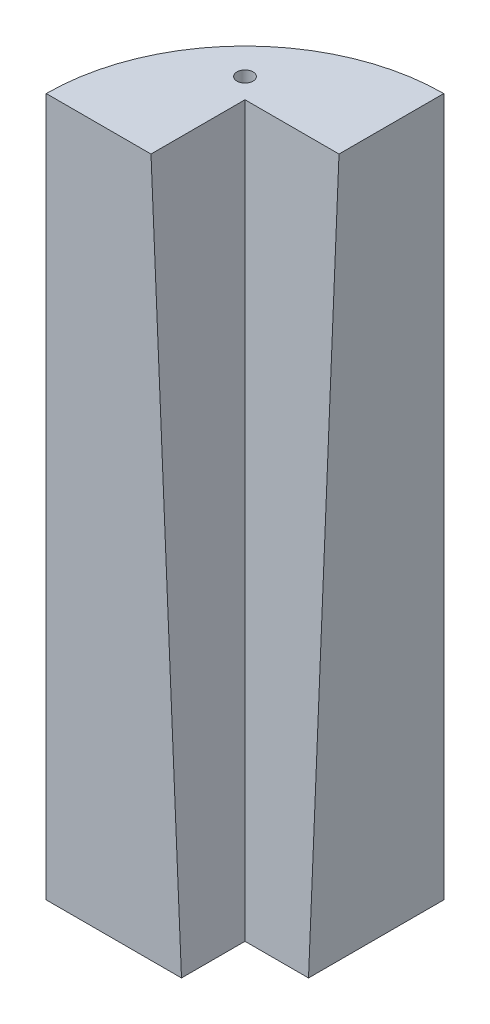
from build123d import *

# Parameters (mm, degrees)
SKETCH1_R           = 46.99
BOSS_EXTRUDE1_DEPTH = 330.2
SKETCH2_W           = 44.45
SKETCH2_H           = 44.45
CUT_EXTRUDE1_DEPTH  = 330.2
CUT_EXTRUDE1_DRAFT  = -2.5
CUT_EXTRUDE2_START  = -330.2
SKETCH3_R           = 1.905
CUT_EXTRUDE2_DEPTH  = 330.2
CUT_EXTRUDE3_DEPTH  = 165.1


with BuildPart() as part:
    # Sketch1 → Boss-Extrude1 (new body)
    with BuildSketch(Plane(origin=(0, 0, 0), x_dir=(1, 0, 0), z_dir=(0, 1, 0))):
        with Locations(Location((0, 0, 0), (0, 0, 270))):
            Circle(SKETCH1_R)
    extrude(amount=BOSS_EXTRUDE1_DEPTH)


with BuildPart() as cut_extrude1_tool:
    # Sketch2 → Cut-Extrude1 (with draft: the straight prism first)
    with BuildSketch(Plane(origin=(0, 330.2, 0), x_dir=(1, 0, 0), z_dir=(0, 1, 0))):
        Rectangle(SKETCH2_W, SKETCH2_H)
    extrude(amount=-CUT_EXTRUDE1_DEPTH)
    # Cut-Extrude1: the draft: its side faces are tilted about the plane it starts from
    cut_extrude1_sides = [cut_extrude1_tool.faces().sort_by_distance(p)[0] for p in [
        (-22.225, 165.1, 0),
        (0, 165.1, 22.225),
        (22.225, 165.1, 0),
        (0, 165.1, -22.225),
    ]]
    draft(cut_extrude1_sides, Plane(origin=(0, 330.2, 0), x_dir=(1, 0, 0), z_dir=(0, 1, 0)), CUT_EXTRUDE1_DRAFT)


with BuildPart() as part_1:
    add(part.part)

    # Cut-Extrude1: cut by cut_extrude1_tool
    add(cut_extrude1_tool.part, mode=Mode.SUBTRACT)

    # Sketch3 → Cut-Extrude2 (cut)
    with BuildSketch(Plane(origin=(0, 330.2, 0), x_dir=(1, 0, 0), z_dir=(0, 1, 0)).offset(CUT_EXTRUDE2_START)):
        with Locations(Location((-26.9875, 26.9875, 0), (0, 0, 270))):
            Circle(SKETCH3_R)
        with BuildLine():
            Line((0, 12.7), (0, 46.99))
            ThreePointArc((0, 46.99), (33.226947648, -33.226947648), (-46.99, 0))
            Line((-46.99, 0), (-12.7, 0))
            Line((-12.7, 0), (0, 0))
            Line((0, 0), (0, 12.7))
        make_face()
    extrude(amount=CUT_EXTRUDE2_DEPTH, mode=Mode.SUBTRACT)

    # Sketch5 → Cut-Extrude3 (cut)
    with BuildSketch(Plane.XZ):
        with BuildLine():
            Line((-46.99, 0), (0, 0))
            Line((0, 0), (0, -46.99))
            ThreePointArc((0, -46.99), (-33.226947648, -33.226947648), (-46.99, 0))
        make_face()
    extrude(amount=-CUT_EXTRUDE3_DEPTH, mode=Mode.SUBTRACT)

    # Boss-Extrude3 cone 1 section (through the dimple's axis) → Boss-Extrude3 (revolve)
    with BuildSketch(Plane(origin=(-31.75, 165.1, -12.7), x_dir=(0, 0, 1), z_dir=(1, 0, 0))):
        Polygon((0, 0), (4.7625, 0), (0, 4.7625), align=None)
    revolve(axis=Axis((-31.75, 165.1, -12.7), (0, -1, 0)))

    # Boss-Extrude3 cone 2 section (through the dimple's axis) → Boss-Extrude3 cone 2 (revolve)
    with BuildSketch(Plane(origin=(-12.7, 165.1, -31.75), x_dir=(0, 0, 1), z_dir=(1, 0, 0))):
        Polygon((0, 0), (4.7625, 0), (0, 4.7625), align=None)
    revolve(axis=Axis((-12.7, 165.1, -31.75), (0, -1, 0)))


solid = part_1.part
